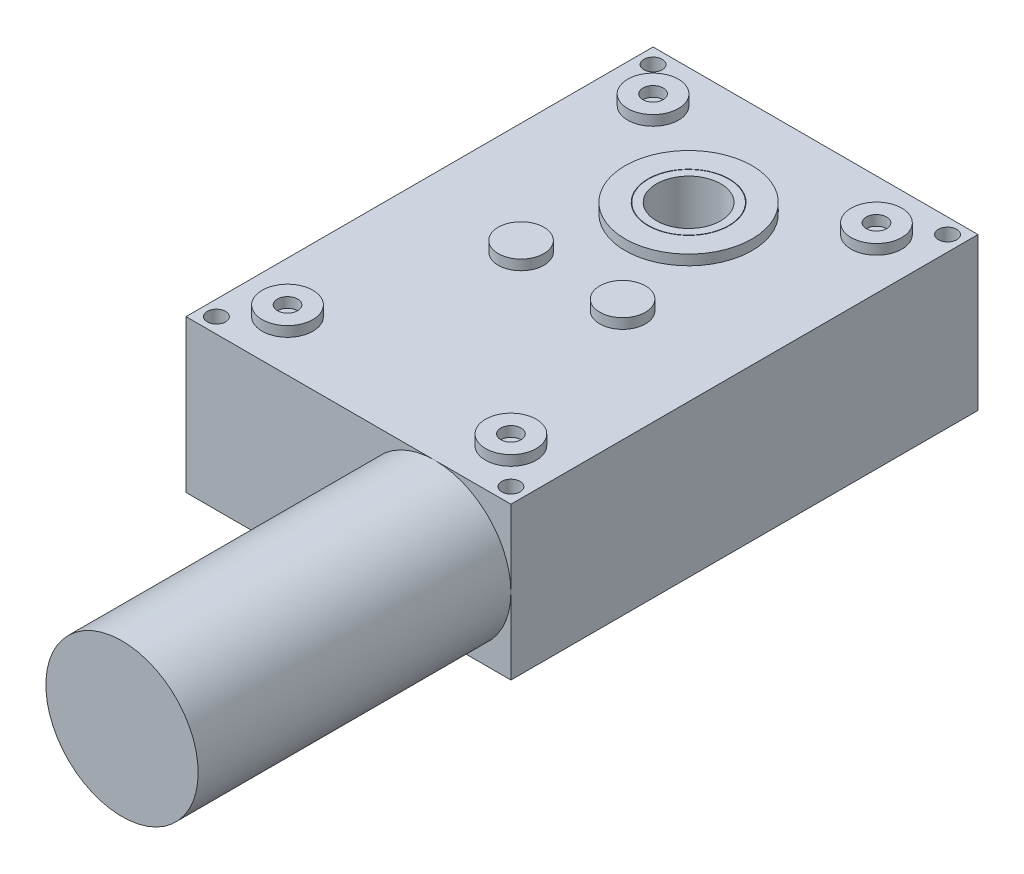
from build123d import *

# Parameters (mm, degrees)
CROQUIS1_W                         = 32
CROQUIS1_H                         = 46
SALIENTE_EXTRUIR1_DEPTH            = 15
CROQUIS2_R                         = 7.5
SALIENTE_EXTRUIR2_DEPTH            = 30.8
CROQUIS3_R                         = 6.25
CROQUIS3_R_2                       = 4
CROQUIS3_R_3                       = 2.5
CROQUIS3_R_4                       = 1
CROQUIS3_R_5                       = 2.25
CROQUIS3_R_6                       = 3.958709401
CROQUIS3_R_7                       = 3.163808824
SALIENTE_EXTRUIR3_DEPTH            = 1
CORTAR_EXTRUIR1_START              = -10
CROQUIS3_3_R                       = 3.163808824
CORTAR_EXTRUIR1_DEPTH              = 10
TALADRO_DE_MARGEN_PARA_M1_41_D     = 1.8
TALADRO_DE_MARGEN_PARA_M1_41_DEPTH = 3
TALADRO_DE_MARGEN_PARA_M1_41_TIP   = 0.540774557


with BuildPart() as part:
    # Croquis1 → Saliente-Extruir1 (new body)
    with BuildSketch(Plane(origin=(0, 0, 0), x_dir=(1, 0, 0), z_dir=(0, 1, 0))):
        Rectangle(CROQUIS1_W, CROQUIS1_H)
    extrude(amount=SALIENTE_EXTRUIR1_DEPTH)

    # Croquis2 → Saliente-Extruir2 (add)
    with BuildSketch(Plane.XY.offset(23)):
        with Locations((8.5, 7.5)):
            Circle(CROQUIS2_R)
    extrude(amount=SALIENTE_EXTRUIR2_DEPTH)

    # Croquis3 → Saliente-Extruir3 (add)
    # profile 1 of 8: a face of its own
    with BuildSketch(Plane(origin=(0, 15, 0), x_dir=(1, 0, 0), z_dir=(0, 1, 0))):
        with Locations((0, 10.5)):
            Circle(CROQUIS3_R)
        with Locations((0, 10.5)):
            Circle(CROQUIS3_R_2, mode=Mode.SUBTRACT)
    # profile 2 of 8: a face of its own
    with BuildSketch(Plane(origin=(0, 15, 0), x_dir=(1, 0, 0), z_dir=(0, 1, 0))):
        with Locations((-11, 18)):
            Circle(CROQUIS3_R_3)
        with Locations((-11, 18)):
            Circle(CROQUIS3_R_4, mode=Mode.SUBTRACT)
    # profile 3 of 8: a face of its own
    with BuildSketch(Plane(origin=(0, 15, 0), x_dir=(1, 0, 0), z_dir=(0, 1, 0))):
        with Locations((-5, -1)):
            Circle(CROQUIS3_R_5)
    # profile 4 of 8: a face of its own
    with BuildSketch(Plane(origin=(0, 15, 0), x_dir=(1, 0, 0), z_dir=(0, 1, 0))):
        with Locations((11, 18)):
            Circle(CROQUIS3_R_3)
        with Locations((11, 18)):
            Circle(CROQUIS3_R_4, mode=Mode.SUBTRACT)
    # profile 5 of 8: a face of its own
    with BuildSketch(Plane(origin=(0, 15, 0), x_dir=(1, 0, 0), z_dir=(0, 1, 0))):
        with Locations((11, -18)):
            Circle(CROQUIS3_R_3)
        with Locations((11, -18)):
            Circle(CROQUIS3_R_4, mode=Mode.SUBTRACT)
    # profile 6 of 8: a face of its own
    with BuildSketch(Plane(origin=(0, 15, 0), x_dir=(1, 0, 0), z_dir=(0, 1, 0))):
        with Locations((-11, -18)):
            Circle(CROQUIS3_R_3)
        with Locations((-11, -18)):
            Circle(CROQUIS3_R_4, mode=Mode.SUBTRACT)
    # profile 7 of 8: a face of its own
    with BuildSketch(Plane(origin=(0, 15, 0), x_dir=(1, 0, 0), z_dir=(0, 1, 0))):
        with Locations((5, -1)):
            Circle(CROQUIS3_R_5)
    # profile 8 of 8: a face of its own
    with BuildSketch(Plane(origin=(0, 15, 0), x_dir=(1, 0, 0), z_dir=(0, 1, 0))):
        with Locations((0, 10.5)):
            Circle(CROQUIS3_R_6)
        with Locations((0, 10.5)):
            Circle(CROQUIS3_R_7, mode=Mode.SUBTRACT)
    extrude(amount=SALIENTE_EXTRUIR3_DEPTH)

    # Croquis3<3> → Cortar-Extruir1 (cut)
    with BuildSketch(Plane(origin=(0, 15, 0), x_dir=(1, 0, 0), z_dir=(0, 1, 0)).offset(CORTAR_EXTRUIR1_START)):
        with Locations((0, 10.5)):
            Circle(CROQUIS3_3_R)
    extrude(amount=CORTAR_EXTRUIR1_DEPTH, mode=Mode.SUBTRACT)

    # Taladro de margen para M1.41
    with Locations(Plane(origin=(0, 15, 0), x_dir=(1, 0, 0), z_dir=(0, 1, 0))):
        with Locations((-14.5, 21.5), (14.5, 21.5), (-14.5, -21.5), (14.5, -21.5)):
            Hole(TALADRO_DE_MARGEN_PARA_M1_41_D / 2, depth=TALADRO_DE_MARGEN_PARA_M1_41_DEPTH)
            with Locations((0, 0, -(TALADRO_DE_MARGEN_PARA_M1_41_DEPTH + TALADRO_DE_MARGEN_PARA_M1_41_TIP / 2))):  # 118° drill point
                Cone(0, TALADRO_DE_MARGEN_PARA_M1_41_D / 2, TALADRO_DE_MARGEN_PARA_M1_41_TIP, mode=Mode.SUBTRACT)


solid = part.part
